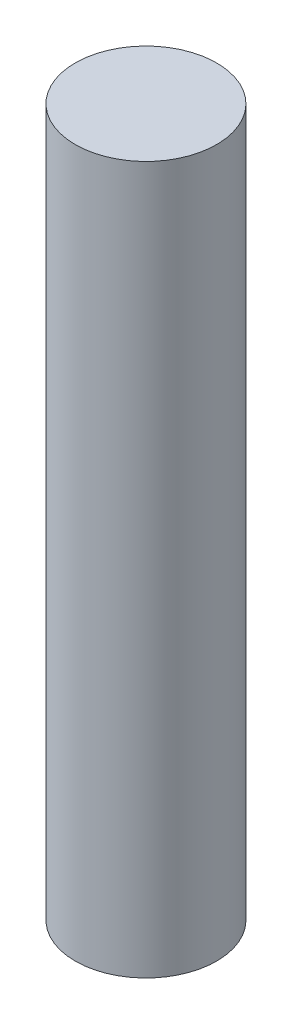
from build123d import *

# Parameters (mm, degrees)
IZIM2_R                     = 1
Y_KSEKLIK_EKSTR_ZYON1_DEPTH = 10


with BuildPart() as part:
    # Çizim2 → Yükseklik-Ekstrüzyon1 (new body)
    with BuildSketch(Plane(origin=(0, 0, 0), x_dir=(1, 0, 0), z_dir=(0, 1, 0))):
        with Locations(Location((0, 0, 0), (0, 0, 270))):
            Circle(IZIM2_R)
    extrude(amount=Y_KSEKLIK_EKSTR_ZYON1_DEPTH)


solid = part.part
